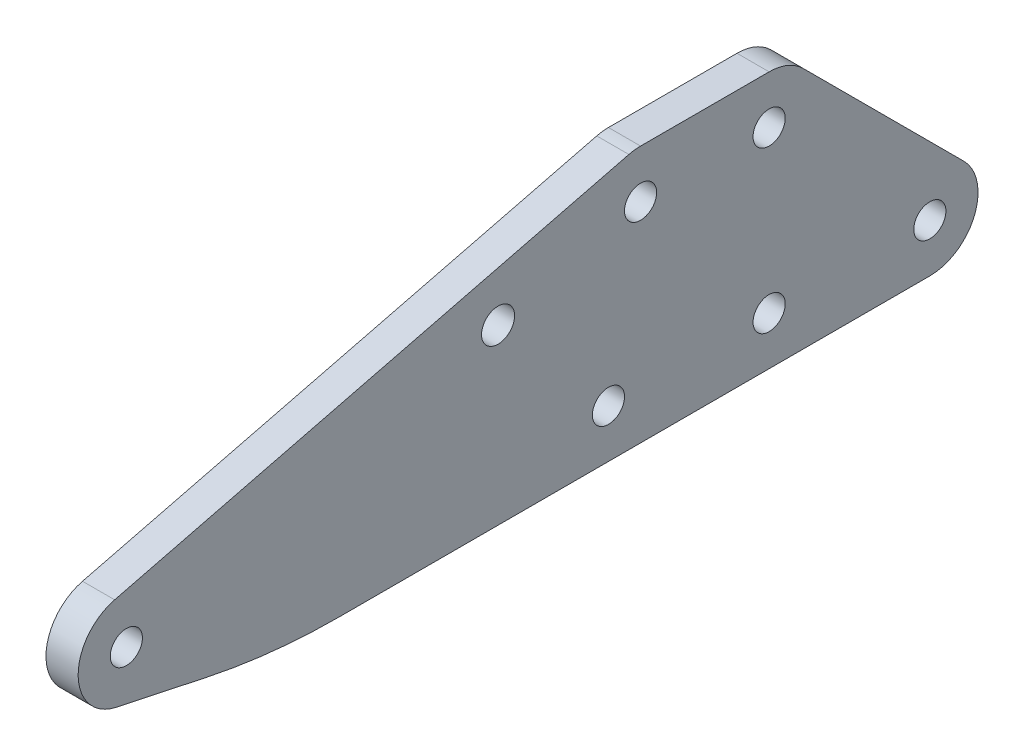
from build123d import *

# Parameters (mm, degrees)
BOSS_EXTRUDE1_START = -47.625
SKETCH1_R           = 3.175
SKETCH1_R_2         = 3.2639
BOSS_EXTRUDE1_DEPTH = 6.35


with BuildPart() as part:
    # Sketch1 → Boss-Extrude1 (new body)
    with BuildSketch(Plane(origin=(0, 0, 0), x_dir=(0, 0, -1), z_dir=(1, 0, 0)).offset(BOSS_EXTRUDE1_START)):
        with BuildLine():
            Line((31.75, 95.375), (-84.778478767, 95.375))
            ThreePointArc((-84.778478767, 95.375), (-98.053593602, 96.070719288), (-111.183263501, 98.150254707))
            Line((-111.183263501, 98.150254707), (-128.980358855, 101.933144103))
            ThreePointArc((-128.980358855, 101.933144103), (-136.523496243, 111.080753692), (-129.310151828, 120.490607314))
            Line((-129.310151828, 120.490607314), (-27.710151828, 145.890607314))
            ThreePointArc((-27.710151828, 145.890607314), (-26.563795587, 146.103634477), (-25.4, 146.175))
            Line((-25.4, 146.175), (0, 146.175))
            ThreePointArc((0, 146.175), (3.645059693, 145.449952547), (6.735192091, 143.385192091))
            Line((6.735192091, 143.385192091), (38.485192091, 111.635192091))
            ThreePointArc((38.485192091, 111.635192091), (40.549952547, 101.254940307), (31.75, 95.375))
        make_face()
        with Locations((-127, 111.25)):
            Circle(SKETCH1_R, mode=Mode.SUBTRACT)
        with Locations((-53.558195394, 129.610451151)):
            Circle(SKETCH1_R_2, mode=Mode.SUBTRACT)
        with Locations((0, 136.65)):
            Circle(SKETCH1_R, mode=Mode.SUBTRACT)
        with Locations((-31.75, 104.9)):
            Circle(SKETCH1_R, mode=Mode.SUBTRACT)
        with Locations((0, 104.9)):
            Circle(SKETCH1_R, mode=Mode.SUBTRACT)
        with Locations((31.75, 104.9)):
            Circle(SKETCH1_R, mode=Mode.SUBTRACT)
        with Locations((-25.4, 136.65)):
            Circle(SKETCH1_R, mode=Mode.SUBTRACT)
    extrude(amount=-BOSS_EXTRUDE1_DEPTH)


solid = part.part
